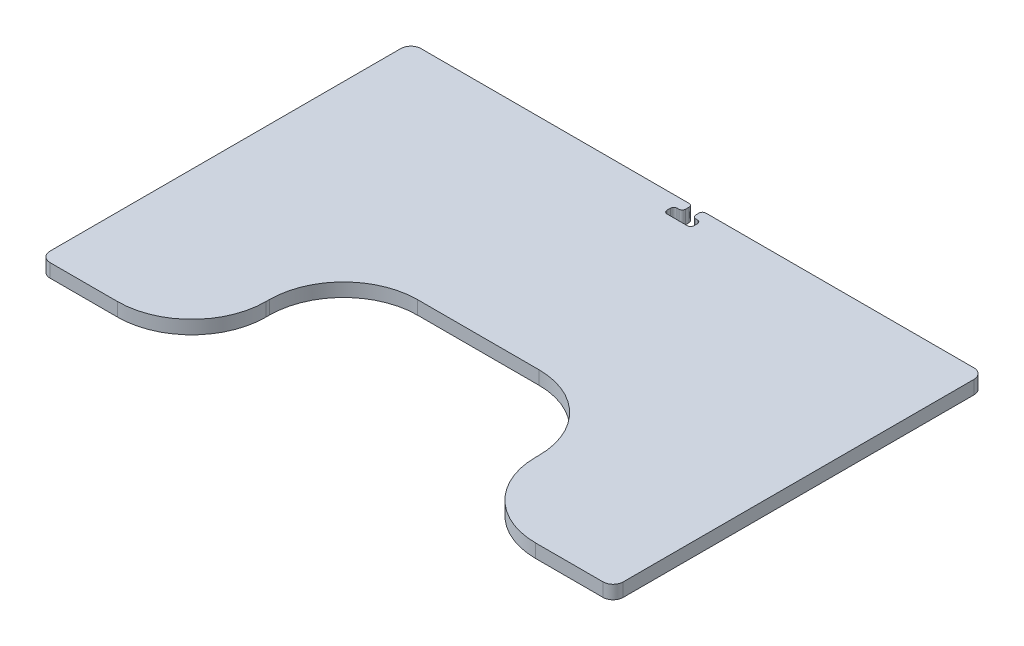
from build123d import *

# Parameters (mm, degrees)
BOSS_EXTRUDE1_DEPTH     = 40
FILLET1_R               = 220
FILLET2_R               = 30
CUT_EXTRUDE1_DEPTH      = 1391.71923838
CUT_EXTRUDE1_DEPTH_BACK = 1391.71923838
FILLET3_R               = 10


with BuildPart() as part:
    # Sketch1 → Boss-Extrude1 (new body)
    with BuildSketch(Plane(origin=(0, 0, 0), x_dir=(1, 0, 0), z_dir=(0, 1, 0))):
        Polygon((850, 1100), (-850, 1100), (-850, 0), (-400, 0), (-400, 450), (400, 450), (400, 0), (850, 0), align=None)
    extrude(amount=BOSS_EXTRUDE1_DEPTH)

    # Fillet1
    fillet1_edges = [part.edges().sort_by_distance(p)[0] for p in [
        (-400, 20, -450),
        (-400, 20, 0),
        (400, 20, 0),
        (400, 20, -450),
    ]]
    fillet(fillet1_edges, radius=FILLET1_R)

    # Fillet2
    fillet2_edges = [part.edges().sort_by_distance(p)[0] for p in [
        (-850, 20, 0),
        (-850, 20, -1100),
        (850, 20, -1100),
        (850, 20, 0),
    ]]
    fillet(fillet2_edges, radius=FILLET2_R)

    # Sketch2 → Cut-Extrude1 (cut, two sides: drawn at the far end of the back side and taken through both)
    with BuildSketch(Plane(origin=(0, 40, 0), x_dir=(1, 0, 0), z_dir=(0, 1, 0)).offset(-CUT_EXTRUDE1_DEPTH_BACK)):
        Polygon((-15, 3908.73185568), (-15, 1100), (-15, 1070), (-40, 1070), (-40, 1040), (40, 1040), (40, 1070), (15, 1070), (15, 1100), (15, 3908.73185568), (15, 9526.195567041), (-15, 9526.195567041), align=None)
    extrude(amount=CUT_EXTRUDE1_DEPTH + CUT_EXTRUDE1_DEPTH_BACK, mode=Mode.SUBTRACT)

    # Fillet3
    fillet3_edges = [part.edges().sort_by_distance(p)[0] for p in [
        (-15, 20, -1070),
        (-40, 20, -1070),
        (-40, 20, -1040),
        (40, 20, -1040),
        (40, 20, -1070),
        (15, 20, -1070),
        (15, 20, -1100),
        (-15, 20, -1100),
    ]]
    fillet(fillet3_edges, radius=FILLET3_R)


solid = part.part
